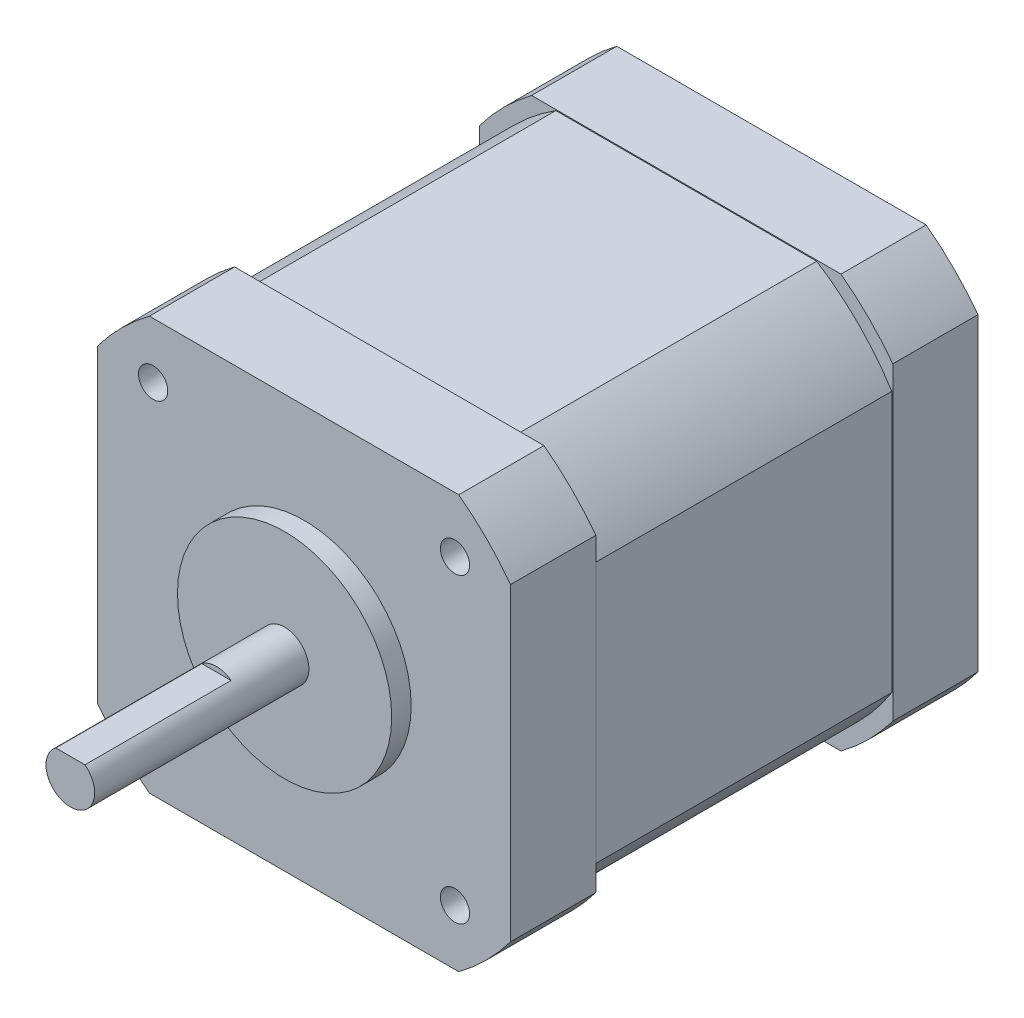
from build123d import *

# Parameters (mm, degrees)
SKETCH1_R            = 2.5
BOSS_EXTRUDE1_DEPTH  = 24
SKETCH2_R            = 11
BOSS_EXTRUDE2_DEPTH  = 2
SKETCH3_W            = 42.418
SKETCH3_H            = 42.418
BOSS_EXTRUDE3_DEPTH  = 48
CUT_EXTRUDE1_DEPTH   = 78.997713825
M3X0_5_1_D           = 2.5
M3X0_5_1_DEPTH       = 7.5
M3X0_5_1_CBORE_D     = 3
M3X0_5_1_CBORE_DEPTH = 6
M3X0_5_1_TIP         = 0.751075774
CUT_EXTRUDE2_START   = -15
CUT_EXTRUDE2_DEPTH   = 15
CUT_EXTRUDE3_DEPTH   = 15.25


with BuildPart() as part:
    # Sketch1 → Boss-Extrude1 (new body)
    with BuildSketch(Plane.XY):
        Circle(SKETCH1_R)
    extrude(amount=BOSS_EXTRUDE1_DEPTH)

    # Sketch2 → Boss-Extrude2 (add)
    with BuildSketch(Plane(origin=(0, 0, 0), x_dir=(-1, 0, 0), z_dir=(0, 0, -1))):
        Circle(SKETCH2_R)
    extrude(amount=-BOSS_EXTRUDE2_DEPTH)

    # Sketch3 → Boss-Extrude3 (add)
    with BuildSketch(Plane(origin=(0, 0, 0), x_dir=(-1, 0, 0), z_dir=(0, 0, -1))):
        Rectangle(SKETCH3_W, SKETCH3_H)
    extrude(amount=BOSS_EXTRUDE3_DEPTH)

    # Sketch4 → Cut-Extrude1 (cut, through all)
    with BuildSketch(Plane(origin=(0, 0, -48), x_dir=(-1, 0, 0), z_dir=(0, 0, -1))):
        with BuildLine():
            Line((-21.209, -15.887992919), (-21.209, -21.209))
            Line((-21.209, -21.209), (-15.887992919, -21.209))
            ThreePointArc((-15.887992919, -21.209), (-18.738329701, -18.738329701), (-21.209, -15.887992919))
        make_face()
        with BuildLine():
            Line((15.887992919, -21.209), (21.209, -21.209))
            Line((21.209, -21.209), (21.209, -15.887992919))
            ThreePointArc((21.209, -15.887992919), (18.738329701, -18.738329701), (15.887992919, -21.209))
        make_face()
        with BuildLine():
            Line((21.209, 15.887992919), (21.209, 21.209))
            Line((21.209, 21.209), (15.887992919, 21.209))
            ThreePointArc((15.887992919, 21.209), (18.738329701, 18.738329701), (21.209, 15.887992919))
        make_face()
        with BuildLine():
            Line((-15.887992919, 21.209), (-21.209, 21.209))
            Line((-21.209, 21.209), (-21.209, 15.887992919))
            ThreePointArc((-21.209, 15.887992919), (-18.738329701, 18.738329701), (-15.887992919, 21.209))
        make_face()
    extrude(amount=-CUT_EXTRUDE1_DEPTH, mode=Mode.SUBTRACT)

    # M3x0.5 螺纹孔1
    with Locations(Plane.XY):
        with Locations((-15.5, 15.5), (-15.5, -15.5), (15.5, -15.5), (15.5, 15.5)):
            CounterBoreHole(M3X0_5_1_D / 2, M3X0_5_1_CBORE_D / 2, M3X0_5_1_CBORE_DEPTH, depth=M3X0_5_1_DEPTH)
            with Locations((0, 0, -(M3X0_5_1_DEPTH + M3X0_5_1_TIP / 2))):  # 118° drill point
                Cone(0, M3X0_5_1_D / 2, M3X0_5_1_TIP, mode=Mode.SUBTRACT)

    # Sketch7 → Cut-Extrude2 (cut)
    with BuildSketch(Plane.XY.offset(24).offset(CUT_EXTRUDE2_START)):
        with BuildLine():
            Line((-1.5, 2), (1.5, 2))
            ThreePointArc((1.5, 2), (0, 2.5), (-1.5, 2))
        make_face()
    extrude(amount=CUT_EXTRUDE2_DEPTH, mode=Mode.SUBTRACT)

    # Sketch8 → Cut-Extrude3 (cut, symmetric)
    with BuildSketch(Plane.XY.offset(-24)):
        with BuildLine():
            Line((15.887992919, 21.209), (-15.887992919, 21.209))
            ThreePointArc((-15.887992919, 21.209), (-18.738329701, 18.738329701), (-21.209, 15.887992919))
            Line((-21.209, 15.887992919), (-21.209, -15.887992919))
            ThreePointArc((-21.209, -15.887992919), (-18.738329701, -18.738329701), (-15.887992919, -21.209))
            Line((-15.887992919, -21.209), (15.887992919, -21.209))
            ThreePointArc((15.887992919, -21.209), (18.738329701, -18.738329701), (21.209, -15.887992919))
            Line((21.209, -15.887992919), (21.209, 15.887992919))
            ThreePointArc((21.209, 15.887992919), (18.738329701, 18.738329701), (15.887992919, 21.209))
        make_face()
        with BuildLine():
            Line((-13.394406258, 21.109), (13.394406258, 21.109))
            ThreePointArc((13.394406258, 21.109), (17.67766953, 17.67766953), (21.109, 13.394406258))
            Line((21.109, 13.394406258), (21.109, -13.394406258))
            ThreePointArc((21.109, -13.394406258), (17.67766953, -17.67766953), (13.394406258, -21.109))
            Line((13.394406258, -21.109), (-13.394406258, -21.109))
            ThreePointArc((-13.394406258, -21.109), (-17.67766953, -17.67766953), (-21.109, -13.394406258))
            Line((-21.109, -13.394406258), (-21.109, 13.394406258))
            ThreePointArc((-21.109, 13.394406258), (-17.67766953, 17.67766953), (-13.394406258, 21.109))
        make_face(mode=Mode.SUBTRACT)
    extrude(amount=CUT_EXTRUDE3_DEPTH, both=True, mode=Mode.SUBTRACT)


solid = part.part
